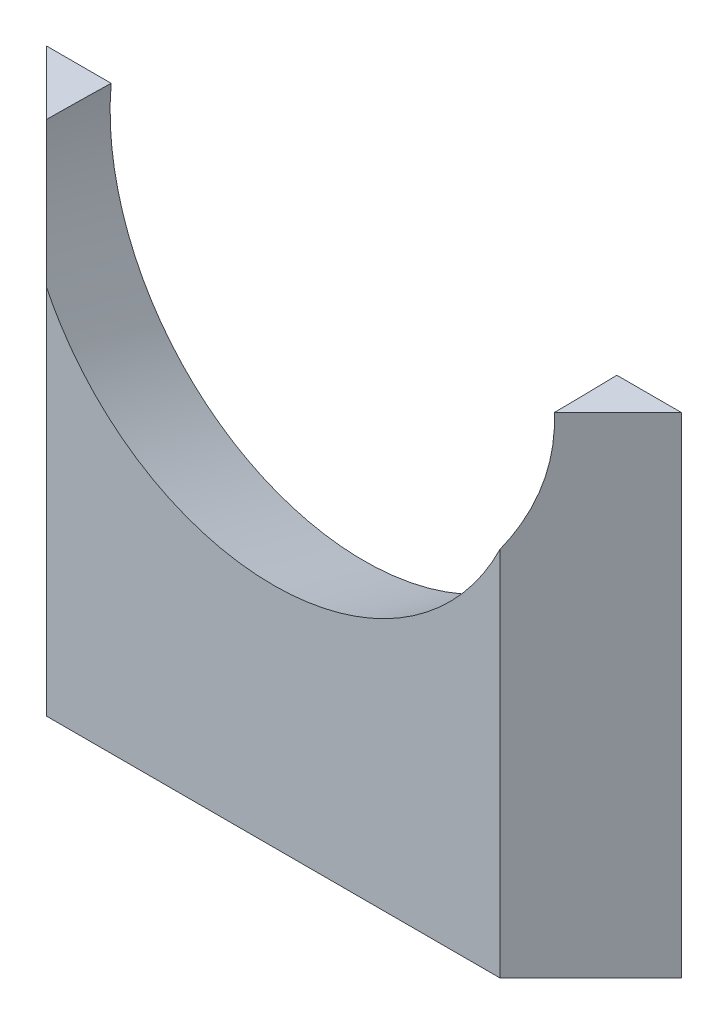
from build123d import *

# Parameters (mm, degrees)
BOSS_EXTRUDE1_DEPTH     = 27
CUT_EXTRUDE1_DEPTH      = 33.019431415
CUT_EXTRUDE1_DEPTH_BACK = 33.019431415
SKETCH2_R               = 14


with BuildPart() as part:
    # Sketch1 → Boss-Extrude1 (new body)
    with BuildSketch(Plane(origin=(0, 0, 0), x_dir=(1, 0, 0), z_dir=(0, 1, 0))):
        Polygon((-17.5, 2.5), (17.5, 2.5), (12.5, -2.5), (-12.5, -2.5), align=None)
    extrude(amount=BOSS_EXTRUDE1_DEPTH)

    # Sketch2 → Cut-Extrude1 (cut, two sides: drawn at the far end of the back side and taken through both)
    with BuildSketch(Plane(origin=(0, 0.625, 2.332531755), x_dir=(1, 0, 0), z_dir=(0, 0.25881904510251796, 0.9659258262890691)).offset(-CUT_EXTRUDE1_DEPTH_BACK)):
        with Locations((0, 25.432949697)):
            Circle(SKETCH2_R)
    extrude(amount=CUT_EXTRUDE1_DEPTH + CUT_EXTRUDE1_DEPTH_BACK, mode=Mode.SUBTRACT)


solid = part.part
